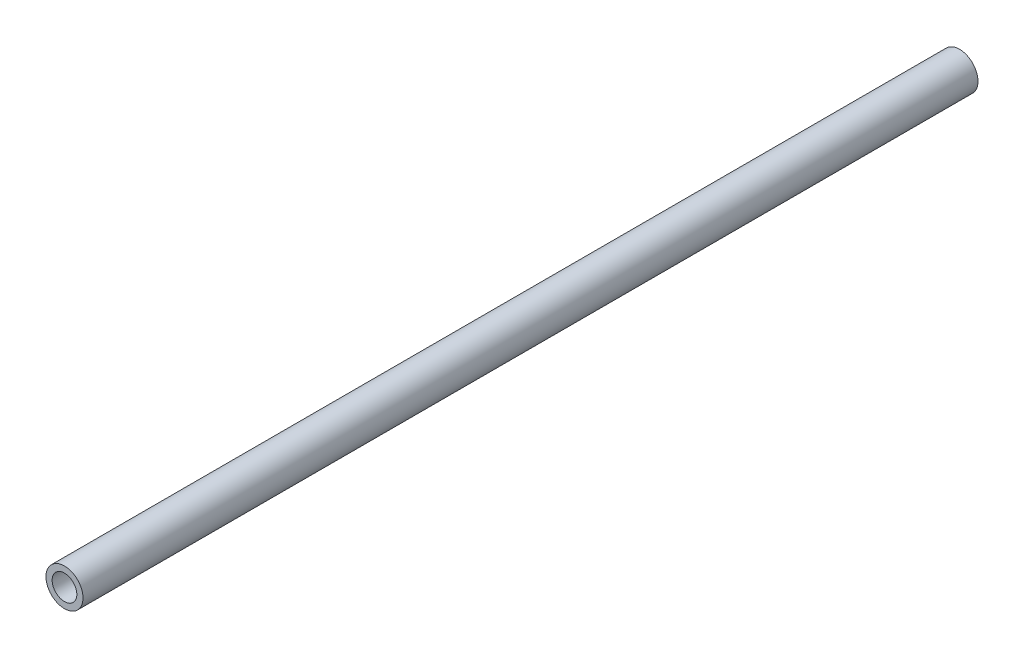
from build123d import *

# Parameters (mm, degrees)
SKETCH1_R           = 3
SKETCH1_R_2         = 2
BOSS_EXTRUDE1_DEPTH = 145


with BuildPart() as part:
    # Sketch1 → Boss-Extrude1 (new body)
    with BuildSketch(Plane.XY):
        Circle(SKETCH1_R)
        Circle(SKETCH1_R_2, mode=Mode.SUBTRACT)
    extrude(amount=BOSS_EXTRUDE1_DEPTH)


solid = part.part
